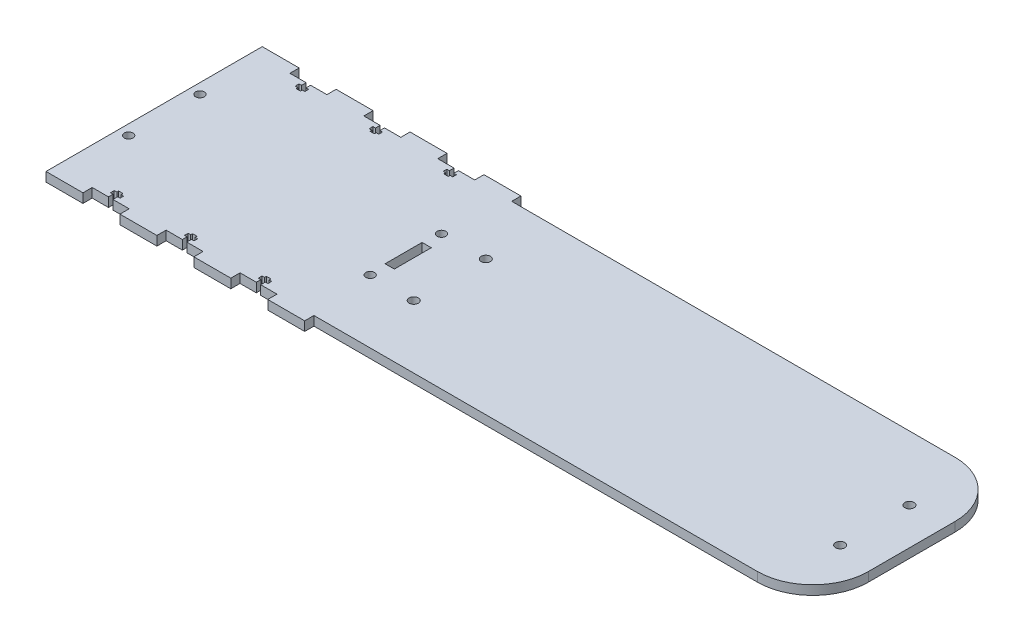
from build123d import *

# Parameters (mm, degrees)
SKETCH1_R           = 3.175
SKETCH1_R_2         = 2.999994
BOSS_EXTRUDE1_DEPTH = 6.35


with BuildPart() as part:
    # Sketch1 → Boss-Extrude1 (new body)
    with BuildSketch(Plane(origin=(0, 0, 0), x_dir=(1, 0, 0), z_dir=(0, 1, 0))):
        with BuildLine():
            Line((-254.430272712, 52.159060564), (-254.430272712, -83.730939436))
            Line((-254.430272712, -83.730939436), (-254.430272712, -90.080939436))
            Line((-254.430272712, -90.080939436), (-229.030272712, -90.080939436))
            Line((-229.030272712, -90.080939436), (-229.030272712, -83.730939436))
            Line((-229.030272712, -83.730939436), (-217.85420239, -83.730939436))
            Line((-217.85420239, -83.730939436), (-217.85420239, -80.555939436))
            Line((-217.85420239, -80.555939436), (-219.60680239, -80.555939436))
            Line((-219.60680239, -80.555939436), (-219.60680239, -78.015939436))
            Line((-219.60680239, -78.015939436), (-217.85420239, -78.015939436))
            Line((-217.85420239, -78.015939436), (-217.85420239, -76.745939436))
            Line((-217.85420239, -76.745939436), (-214.806343034, -76.745939436))
            Line((-214.806343034, -76.745939436), (-214.806343034, -78.015939436))
            Line((-214.806343034, -78.015939436), (-213.053743034, -78.015939436))
            Line((-213.053743034, -78.015939436), (-213.053743034, -80.555939436))
            Line((-213.053743034, -80.555939436), (-214.806343034, -80.555939436))
            Line((-214.806343034, -80.555939436), (-214.806343034, -83.730939436))
            Line((-214.806343034, -83.730939436), (-203.630272712, -83.730939436))
            Line((-203.630272712, -83.730939436), (-203.630272712, -90.080939436))
            Line((-203.630272712, -90.080939436), (-178.230272712, -90.080939436))
            Line((-178.230272712, -90.080939436), (-178.230272712, -83.730939436))
            Line((-178.230272712, -83.730939436), (-167.05420239, -83.730939436))
            Line((-167.05420239, -83.730939436), (-167.05420239, -80.555939436))
            Line((-167.05420239, -80.555939436), (-168.80680239, -80.555939436))
            Line((-168.80680239, -80.555939436), (-168.80680239, -78.015939436))
            Line((-168.80680239, -78.015939436), (-167.05420239, -78.015939436))
            Line((-167.05420239, -78.015939436), (-167.05420239, -76.745939436))
            Line((-167.05420239, -76.745939436), (-164.006343034, -76.745939436))
            Line((-164.006343034, -76.745939436), (-164.006343034, -78.015939436))
            Line((-164.006343034, -78.015939436), (-162.253743034, -78.015939436))
            Line((-162.253743034, -78.015939436), (-162.253743034, -80.555939436))
            Line((-162.253743034, -80.555939436), (-164.006343034, -80.555939436))
            Line((-164.006343034, -80.555939436), (-164.006343034, -83.730939436))
            Line((-164.006343034, -83.730939436), (-152.830272712, -83.730939436))
            Line((-152.830272712, -83.730939436), (-152.830272712, -90.080939436))
            Line((-152.830272712, -90.080939436), (-127.430272712, -90.080939436))
            Line((-127.430272712, -90.080939436), (-127.430272712, -83.730939436))
            Line((-127.430272712, -83.730939436), (-116.25420239, -83.730939436))
            Line((-116.25420239, -83.730939436), (-116.25420239, -80.555939436))
            Line((-116.25420239, -80.555939436), (-118.00680239, -80.555939436))
            Line((-118.00680239, -80.555939436), (-118.00680239, -78.015939436))
            Line((-118.00680239, -78.015939436), (-116.25420239, -78.015939436))
            Line((-116.25420239, -78.015939436), (-116.25420239, -76.745939436))
            Line((-116.25420239, -76.745939436), (-113.206343034, -76.745939436))
            Line((-113.206343034, -76.745939436), (-113.206343034, -78.015939436))
            Line((-113.206343034, -78.015939436), (-111.453743034, -78.015939436))
            Line((-111.453743034, -78.015939436), (-111.453743034, -80.555939436))
            Line((-111.453743034, -80.555939436), (-113.206343034, -80.555939436))
            Line((-113.206343034, -80.555939436), (-113.206343034, -83.730939436))
            Line((-113.206343034, -83.730939436), (-102.030272712, -83.730939436))
            Line((-102.030272712, -83.730939436), (-102.030272712, -90.080939436))
            Line((-102.030272712, -90.080939436), (-76.630272712, -90.080939436))
            Line((-76.630272712, -90.080939436), (-76.630272712, -83.730939436))
            Line((-76.630272712, -83.730939436), (228.169727288, -83.730939436))
            ThreePointArc((228.169727288, -83.730939436), (255.110495652, -72.571707799), (266.269727288, -45.630939436))
            Line((266.269727288, -45.630939436), (266.269727288, 14.059060564))
            ThreePointArc((266.269727288, 14.059060564), (255.110495652, 40.999828928), (228.169727288, 52.159060564))
            Line((228.169727288, 52.159060564), (-76.630272712, 52.159060564))
            Line((-76.630272712, 52.159060564), (-76.630272712, 58.509060564))
            Line((-76.630272712, 58.509060564), (-102.030272712, 58.509060564))
            Line((-102.030272712, 58.509060564), (-102.030272712, 52.159060564))
            Line((-102.030272712, 52.159060564), (-113.206343034, 52.159060564))
            Line((-113.206343034, 52.159060564), (-113.206343034, 48.984060564))
            Line((-113.206343034, 48.984060564), (-111.453743034, 48.984060564))
            Line((-111.453743034, 48.984060564), (-111.453743034, 46.444060564))
            Line((-111.453743034, 46.444060564), (-113.206343034, 46.444060564))
            Line((-113.206343034, 46.444060564), (-113.206343034, 45.174060564))
            Line((-113.206343034, 45.174060564), (-116.25420239, 45.174060564))
            Line((-116.25420239, 45.174060564), (-116.25420239, 46.444060564))
            Line((-116.25420239, 46.444060564), (-118.00680239, 46.444060564))
            Line((-118.00680239, 46.444060564), (-118.00680239, 48.984060564))
            Line((-118.00680239, 48.984060564), (-116.25420239, 48.984060564))
            Line((-116.25420239, 48.984060564), (-116.25420239, 52.159060564))
            Line((-116.25420239, 52.159060564), (-127.430272712, 52.159060564))
            Line((-127.430272712, 52.159060564), (-127.430272712, 58.509060564))
            Line((-127.430272712, 58.509060564), (-152.830272712, 58.509060564))
            Line((-152.830272712, 58.509060564), (-152.830272712, 52.159060564))
            Line((-152.830272712, 52.159060564), (-164.006343034, 52.159060564))
            Line((-164.006343034, 52.159060564), (-164.006343034, 48.984060564))
            Line((-164.006343034, 48.984060564), (-162.253743034, 48.984060564))
            Line((-162.253743034, 48.984060564), (-162.253743034, 46.444060564))
            Line((-162.253743034, 46.444060564), (-164.006343034, 46.444060564))
            Line((-164.006343034, 46.444060564), (-164.006343034, 45.174060564))
            Line((-164.006343034, 45.174060564), (-167.05420239, 45.174060564))
            Line((-167.05420239, 45.174060564), (-167.05420239, 46.444060564))
            Line((-167.05420239, 46.444060564), (-168.80680239, 46.444060564))
            Line((-168.80680239, 46.444060564), (-168.80680239, 48.984060564))
            Line((-168.80680239, 48.984060564), (-167.05420239, 48.984060564))
            Line((-167.05420239, 48.984060564), (-167.05420239, 52.159060564))
            Line((-167.05420239, 52.159060564), (-178.230272712, 52.159060564))
            Line((-178.230272712, 52.159060564), (-178.230272712, 58.509060564))
            Line((-178.230272712, 58.509060564), (-203.630272712, 58.509060564))
            Line((-203.630272712, 58.509060564), (-203.630272712, 52.159060564))
            Line((-203.630272712, 52.159060564), (-214.806343034, 52.159060564))
            Line((-214.806343034, 52.159060564), (-214.806343034, 48.984060564))
            Line((-214.806343034, 48.984060564), (-213.053743034, 48.984060564))
            Line((-213.053743034, 48.984060564), (-213.053743034, 46.444060564))
            Line((-213.053743034, 46.444060564), (-214.806343034, 46.444060564))
            Line((-214.806343034, 46.444060564), (-214.806343034, 45.174060564))
            Line((-214.806343034, 45.174060564), (-217.85420239, 45.174060564))
            Line((-217.85420239, 45.174060564), (-217.85420239, 46.444060564))
            Line((-217.85420239, 46.444060564), (-219.60680239, 46.444060564))
            Line((-219.60680239, 46.444060564), (-219.60680239, 48.984060564))
            Line((-219.60680239, 48.984060564), (-217.85420239, 48.984060564))
            Line((-217.85420239, 48.984060564), (-217.85420239, 52.159060564))
            Line((-217.85420239, 52.159060564), (-229.030272712, 52.159060564))
            Line((-229.030272712, 52.159060564), (-229.030272712, 58.509060564))
            Line((-229.030272712, 58.509060564), (-254.430272712, 58.509060564))
            Line((-254.430272712, 58.509060564), (-254.430272712, 52.159060564))
        make_face()
        with Locations(Location((240.869727288, 8.026560564, 0), (0, 0, 270))):
            Circle(SKETCH1_R, mode=Mode.SUBTRACT)
        with Locations(Location((240.869727288, -39.598439436, 0), (0, 0, 270))):
            Circle(SKETCH1_R, mode=Mode.SUBTRACT)
        with Locations(Location((-51.230272712, -40.550939436, 0), (0, 0, 270))):
            Circle(SKETCH1_R, mode=Mode.SUBTRACT)
        with Locations(Location((-51.230272712, 8.979060564, 0), (0, 0, 270))):
            Circle(SKETCH1_R, mode=Mode.SUBTRACT)
        with Locations(Location((-247.430286712, 8.714138564, 0), (0, 0, 270))):
            Circle(SKETCH1_R_2, mode=Mode.SUBTRACT)
        with Locations(Location((-247.430286712, -40.286017436, 0), (0, 0, 270))):
            Circle(SKETCH1_R_2, mode=Mode.SUBTRACT)
        with Locations(Location((-81.430364712, 8.714138564, 0), (0, 0, 270))):
            Circle(SKETCH1_R_2, mode=Mode.SUBTRACT)
        with Locations(Location((-81.430364712, -40.286017436, 0), (0, 0, 270))):
            Circle(SKETCH1_R_2, mode=Mode.SUBTRACT)
        Polygon((-76.630272712, -15.785939436), (-76.630272712, -3.085939436), (-82.959141148, -3.085939436), (-82.959141148, -28.485939436), (-76.630272712, -28.485939436), align=None, mode=Mode.SUBTRACT)
    extrude(amount=BOSS_EXTRUDE1_DEPTH)


solid = part.part
